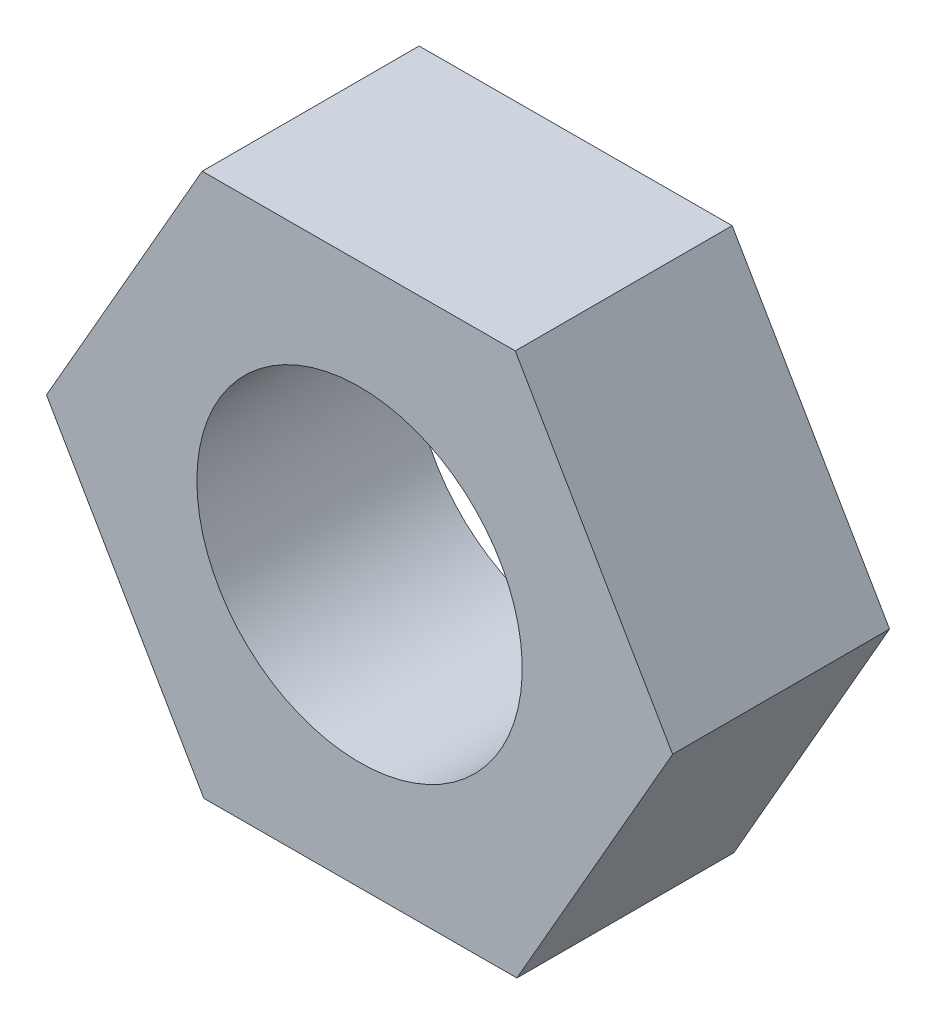
from build123d import *

# Parameters (mm, degrees)
BOSS_EXTRUDE1_DEPTH = 6.35
SKETCH2_R           = 4.7625
CUT_EXTRUDE1_DEPTH  = 14.694918129


with BuildPart() as part:
    # Sketch1 → Boss-Extrude1 (new body)
    with BuildSketch(Plane.XY):
        Polygon((4.606735395, -7.923584879), (9.165393492, 0.027757441), (4.558658097, 7.95134232), (-4.606735395, 7.923584879), (-9.165393492, -0.027757441), (-4.558658097, -7.95134232), align=None)
    extrude(amount=BOSS_EXTRUDE1_DEPTH)

    # Sketch2 → Cut-Extrude1 (cut, through all)
    with BuildSketch(Plane(origin=(0, 0, 0), x_dir=(-1, 0, 0), z_dir=(0, 0, -1))):
        Circle(SKETCH2_R)
    extrude(amount=-CUT_EXTRUDE1_DEPTH, mode=Mode.SUBTRACT)


solid = part.part
